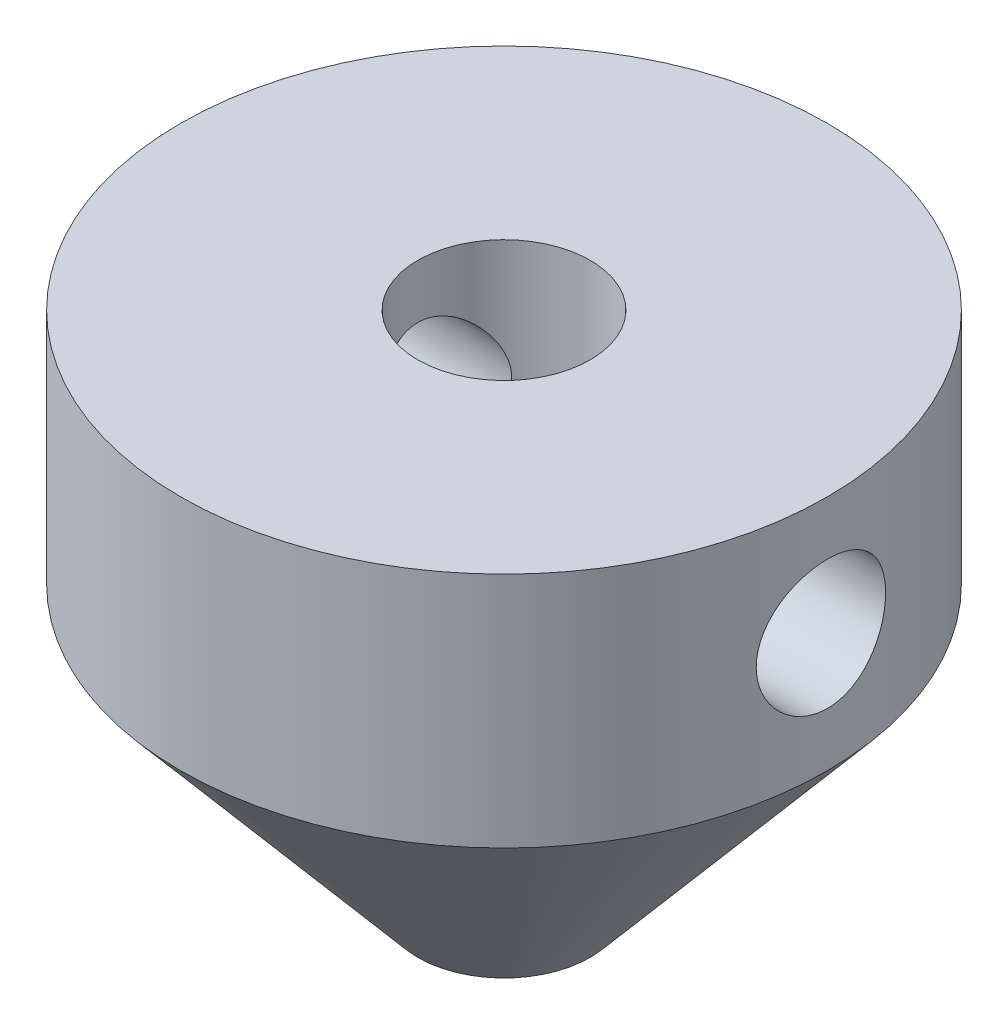
from build123d import *

# Parameters (mm, degrees)
CUT_EXTRUDE1_DEPTH      = 17.015617378
CUT_EXTRUDE1_DEPTH_BACK = 17.015617378
SKETCH2_R               = 1.5
SKETCH3_R               = 2
CUT_EXTRUDE2_DEPTH      = 17.015617484


with BuildPart() as part:
    # Sketch1 → Revolve1 (revolve)
    with BuildSketch(Plane(origin=(0, 0, 0), x_dir=(0, 0, -1), z_dir=(1, 0, 0)), mode=Mode.PRIVATE) as revolve1_sk:
        Polygon((0, 0), (-7.5, 0), (-7.5, -5.5), (-2, -12), (0, -12), align=None)
    revolve(revolve1_sk.sketch.rotate(Axis((0, -12, 0), (0, 1, 0)), 180), axis=Axis((0, -12, 0), (0, 1, 0)))

    # Sketch2 → Cut-Extrude1 (cut, two sides: drawn at the far end of the back side and taken through both)
    with BuildSketch(Plane(origin=(0, 0, 0), x_dir=(0, 0, -1), z_dir=(1, 0, 0)).offset(-CUT_EXTRUDE1_DEPTH_BACK)):
        with Locations((0, -2.75)):
            Circle(SKETCH2_R)
    extrude(amount=CUT_EXTRUDE1_DEPTH + CUT_EXTRUDE1_DEPTH_BACK, mode=Mode.SUBTRACT)

    # Sketch3 → Cut-Extrude2 (cut, through all)
    with BuildSketch(Plane(origin=(0, 0, 0), x_dir=(1, 0, 0), z_dir=(0, 1, 0))):
        with Locations(Location((0, 0, 0), (0, 0, 270))):
            Circle(SKETCH3_R)
    extrude(amount=-CUT_EXTRUDE2_DEPTH, mode=Mode.SUBTRACT)


solid = part.part
